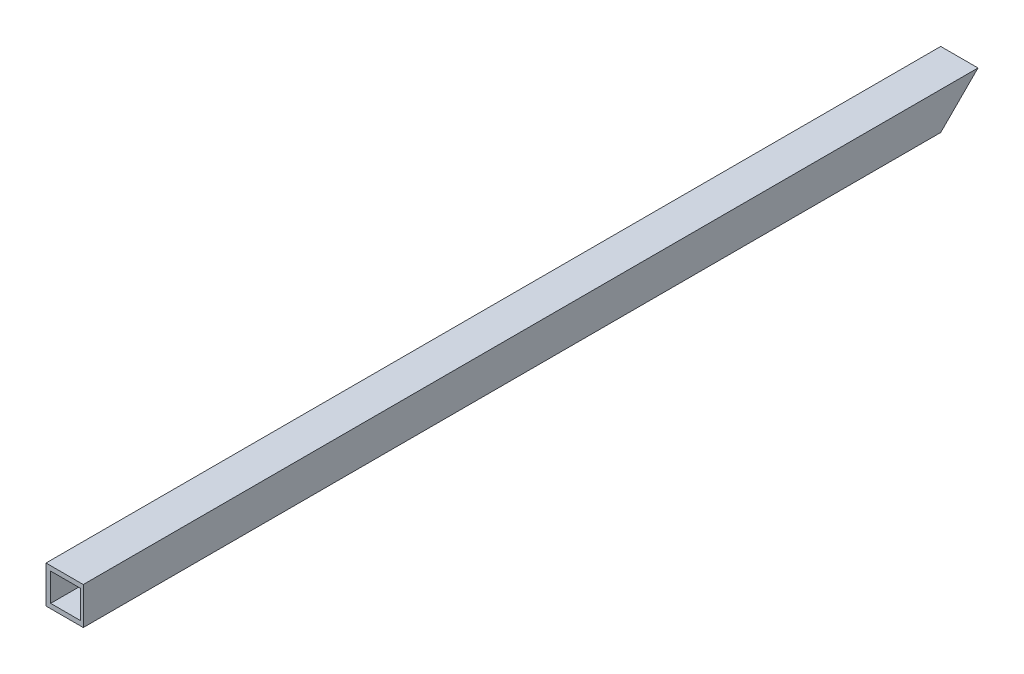
from build123d import *

# Parameters (mm, degrees)
SKETCH1_W           = 25.4
SKETCH1_H           = 25.4
BOSS_EXTRUDE2_DEPTH = 609.6
SKETCH2_W           = 20.302766191
SKETCH2_H           = 19.05
CUT_EXTRUDE1_DEPTH  = 611.657416233
CUT_EXTRUDE2_DEPTH  = 611.657416233


with BuildPart() as part:
    # Sketch1 → Boss-Extrude2 (new body)
    with BuildSketch(Plane.XY):
        with Locations((12.7, 12.7)):
            Rectangle(SKETCH1_W, SKETCH1_H)
    extrude(amount=BOSS_EXTRUDE2_DEPTH)

    # Sketch2 → Cut-Extrude1 (cut, through all)
    with BuildSketch(Plane(origin=(0, 0, 0), x_dir=(-1, 0, 0), z_dir=(0, 0, -1))):
        with Locations((-13.326383096, 12.7)):
            Rectangle(SKETCH2_W, SKETCH2_H)
    extrude(amount=-CUT_EXTRUDE1_DEPTH, mode=Mode.SUBTRACT)

    # Sketch3 → Cut-Extrude2 (cut, through all)
    with BuildSketch(Plane(origin=(25.4, 0, 0), x_dir=(0, 0, -1), z_dir=(1, 0, 0))):
        Polygon((0, 25.4), (-25.4, 0), (0, 0), align=None)
    extrude(amount=-CUT_EXTRUDE2_DEPTH, mode=Mode.SUBTRACT)


solid = part.part
